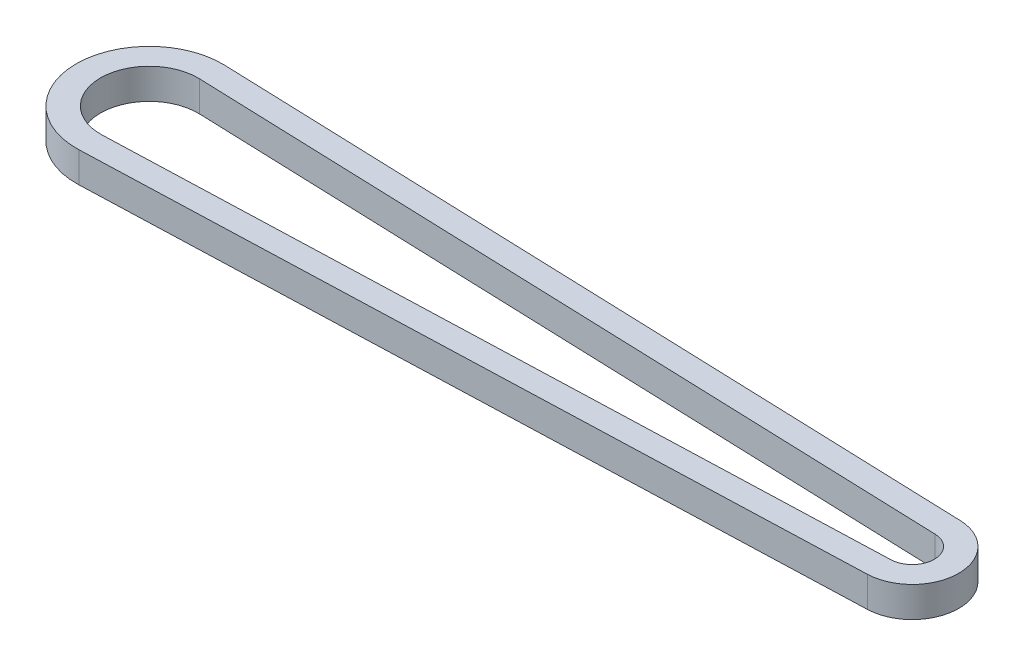
from build123d import *

# Parameters (mm, degrees)
EXTRUDE_THIN1_DEPTH = 12.5


with BuildPart() as part:
    # Sketch1 → Extrude-Thin1 (new body)
    with BuildSketch(Plane(origin=(0, 0, 0), x_dir=(1, 0, 0), z_dir=(0, 1, 0))):
        with BuildLine():
            Line((313.864956778, -19.079324999), (1.044932079, -29.981796426))
            ThreePointArc((1.044932079, -29.981796426), (-30, 0), (1.044932079, 29.981796426))
            Line((1.044932079, 29.981796426), (313.864956778, 19.079324999))
            ThreePointArc((313.864956778, 19.079324999), (332.290909091, 0), (313.864956778, -19.079324999))
        make_face()
        with BuildLine():
            Line((313.516646085, -9.085392856), (0.696621386, -19.987864284))
            ThreePointArc((0.696621386, -19.987864284), (-20, 0), (0.696621386, 19.987864284))
            Line((0.696621386, 19.987864284), (313.516646085, 9.085392856))
            ThreePointArc((313.516646085, 9.085392856), (322.290909091, 0), (313.516646085, -9.085392856))
        make_face(mode=Mode.SUBTRACT)
    extrude(amount=EXTRUDE_THIN1_DEPTH)


solid = part.part
